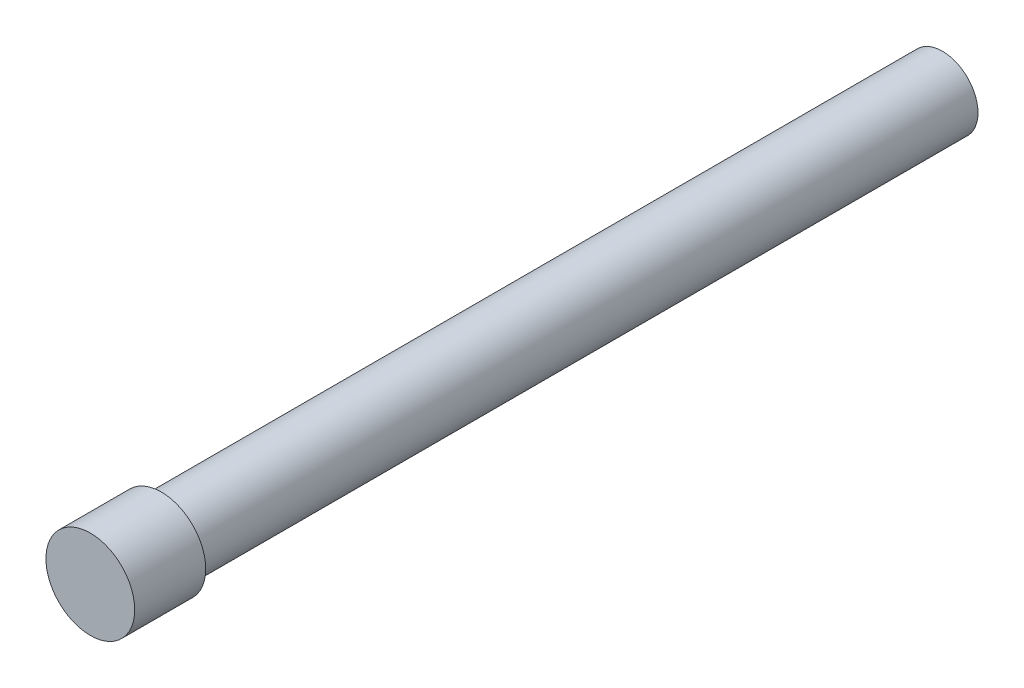
from build123d import *

# Parameters (mm, degrees)
CROQUIS1_R              = 1
SALIENTE_EXTRUIR1_DEPTH = 22
CROQUIS2_R              = 1.25
SALIENTE_EXTRUIR2_DEPTH = 2


with BuildPart() as part:
    # Croquis1 → Saliente-Extruir1 (new body)
    with BuildSketch(Plane.XY):
        Circle(CROQUIS1_R)
    extrude(amount=SALIENTE_EXTRUIR1_DEPTH)

    # Croquis2 → Saliente-Extruir2 (add)
    with BuildSketch(Plane.XY.offset(22)):
        Circle(CROQUIS2_R)
    extrude(amount=SALIENTE_EXTRUIR2_DEPTH)


solid = part.part
